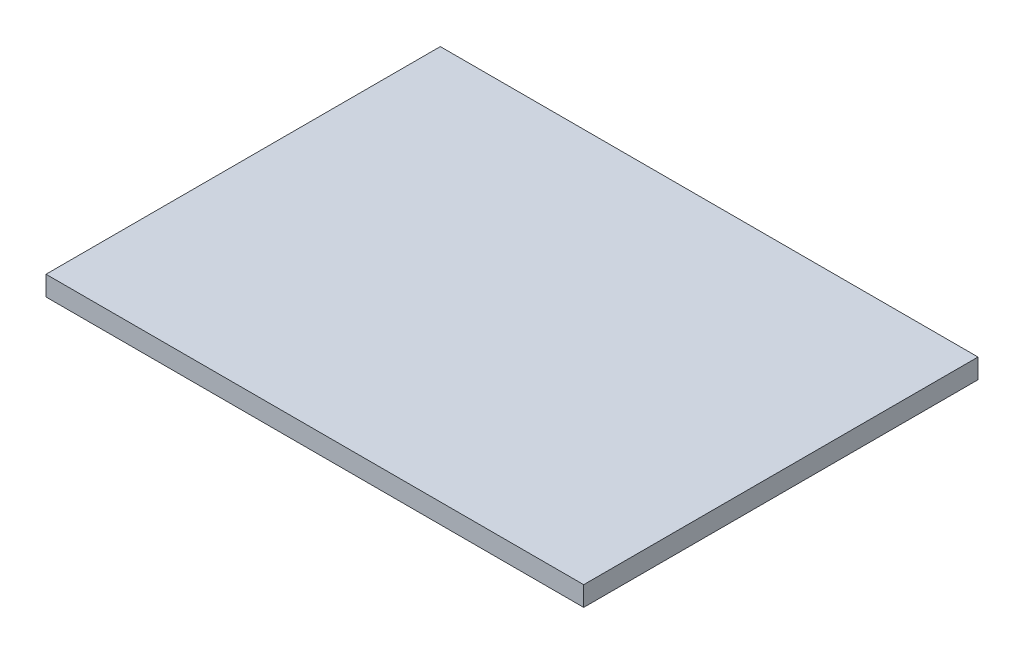
from build123d import *

# Parameters (mm, degrees)
SKETCH_1_W      = 30
SKETCH_1_H      = 22
EXTRUDE_1_DEPTH = 1.1


with BuildPart() as part:
    # 草图1 → 凸台-拉伸1 (new body)
    with BuildSketch(Plane(origin=(0, 0, 0), x_dir=(1, 0, 0), z_dir=(0, 1, 0))):
        with Locations((15, 11)):
            Rectangle(SKETCH_1_W, SKETCH_1_H)
    extrude(amount=EXTRUDE_1_DEPTH)


solid = part.part
